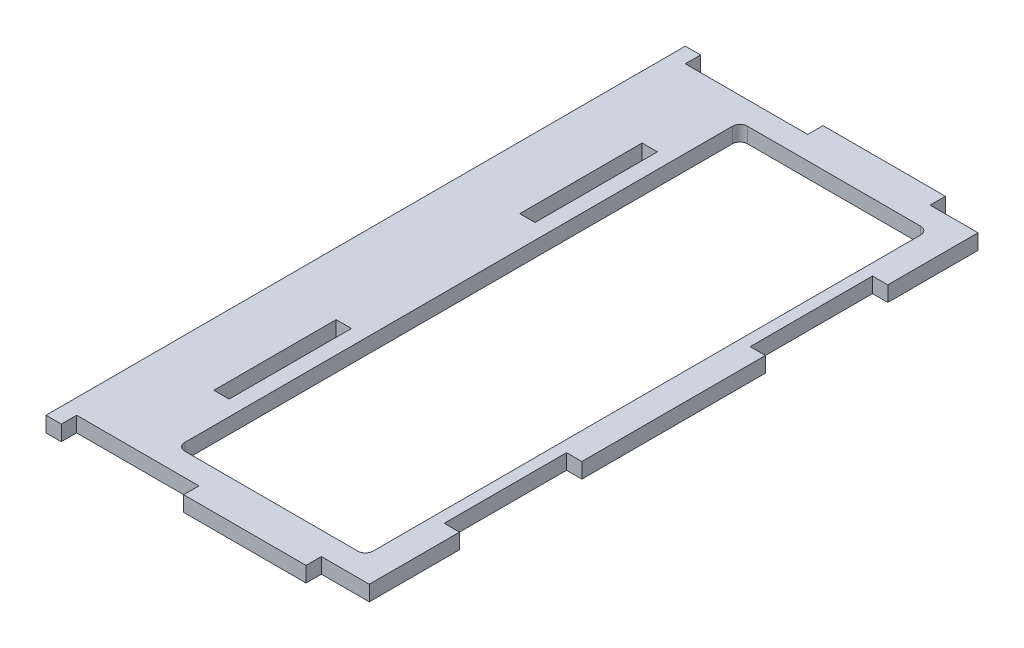
from build123d import *

# Parameters (mm, degrees)
SKETCH5_W           = 395.4
SKETCH5_H           = 265.4
BOSS_EXTRUDE3_DEPTH = 6.35
SKETCH6_W           = 78.175
SKETCH6_H           = 243.175
SKETCH6_W_2         = 75
SKETCH6_H_2         = 240
CUT_EXTRUDE1_DEPTH  = 6.35
SKETCH10_W          = 6.35
SKETCH10_H          = 50.8
SKETCH10_W_2        = 50.8
SKETCH10_H_2        = 6.35
CUT_EXTRUDE2_DEPTH  = 6.35
SKETCH11_W          = 50.8
SKETCH11_H          = 6.35
CUT_EXTRUDE3_DEPTH  = 6.35
SKETCH12_W          = 78.175
SKETCH12_H          = 4.7625
BOSS_EXTRUDE4_DEPTH = 6.35
FILLET1_R           = 3.175
CUT_EXTRUDE4_DEPTH  = 239.190895082


with BuildPart() as part:
    # Sketch5 → Boss-Extrude3 (new body)
    with BuildSketch(Plane(origin=(0, 0, 0), x_dir=(1, 0, 0), z_dir=(0, 1, 0))):
        Rectangle(SKETCH5_W, SKETCH5_H)
    extrude(amount=BOSS_EXTRUDE3_DEPTH)

    # Sketch6 → Cut-Extrude1 (cut)
    # profile 1 of 4: a face of its own
    with BuildSketch(Plane(origin=(0, 6.35, 0), x_dir=(1, 0, 0), z_dir=(0, 1, 0))):
        with Locations((147.5, 0)):
            Rectangle(SKETCH6_W, SKETCH6_H)
        with Locations((147.5, 0)):
            Rectangle(SKETCH6_W_2, SKETCH6_H_2, mode=Mode.SUBTRACT)
    # profile 2 of 4: a face of its own
    with BuildSketch(Plane(origin=(0, 6.35, 0), x_dir=(1, 0, 0), z_dir=(0, 1, 0))):
        with Locations((147.5, 0)):
            Rectangle(SKETCH6_W_2, SKETCH6_H_2)
    # profile 3 of 4: a face of its own
    with BuildSketch(Plane(origin=(0, 6.35, 0), x_dir=(1, 0, 0), z_dir=(0, 1, 0))):
        with Locations((-147.5, 0)):
            Rectangle(SKETCH6_W, SKETCH6_H)
        with Locations((-147.5, 0)):
            Rectangle(SKETCH6_W_2, SKETCH6_H_2, mode=Mode.SUBTRACT)
    # profile 4 of 4: a face of its own
    with BuildSketch(Plane(origin=(0, 6.35, 0), x_dir=(1, 0, 0), z_dir=(0, 1, 0))):
        with Locations((-147.5, 0)):
            Rectangle(SKETCH6_W_2, SKETCH6_H_2)
    extrude(amount=-CUT_EXTRUDE1_DEPTH, mode=Mode.SUBTRACT)

    # Sketch10 → Cut-Extrude2 (cut)
    with BuildSketch(Plane.XZ):
        with Locations((98.8875, -63.5)):
            Rectangle(SKETCH10_W, SKETCH10_H)
        with Locations((98.8875, 63.5)):
            Rectangle(SKETCH10_W, SKETCH10_H)
        with Locations((-98.8875, 63.5)):
            Rectangle(SKETCH10_W, SKETCH10_H)
        with Locations((-98.8875, -63.5)):
            Rectangle(SKETCH10_W, SKETCH10_H)
        Polygon((197.7, 132.7), (177.8, 132.7), (177.8, 126.35), (191.35, 126.35), (197.7, 126.35), align=None)
        Polygon((127, 132.7), (76.2, 132.7), (76.2, 126.35), (95.7125, 126.35), (102.0625, 126.35), (108.4125, 126.35), (127, 126.35), align=None)
        with Locations((0, 129.525)):
            Rectangle(SKETCH10_W_2, SKETCH10_H_2)
        Polygon((-127, 132.7), (-127, 126.35), (-108.4125, 126.35), (-102.0625, 126.35), (-95.7125, 126.35), (-76.2, 126.35), (-76.2, 132.7), align=None)
        Polygon((-197.7, 126.35), (-191.35, 126.35), (-177.8, 126.35), (-177.8, 132.7), (-197.7, 132.7), align=None)
        Polygon((-177.8, -126.35), (-191.35, -126.35), (-197.7, -126.35), (-197.7, -132.7), (-177.8, -132.7), align=None)
        Polygon((-108.4125, -126.35), (-127, -126.35), (-127, -132.7), (-76.2, -132.7), (-76.2, -126.35), (-95.7125, -126.35), (-102.0625, -126.35), align=None)
        with Locations((0, -129.525)):
            Rectangle(SKETCH10_W_2, SKETCH10_H_2)
        Polygon((76.2, -126.35), (76.2, -132.7), (127, -132.7), (127, -126.35), (108.4125, -126.35), (102.0625, -126.35), (95.7125, -126.35), align=None)
        Polygon((177.8, -126.35), (177.8, -132.7), (197.7, -132.7), (197.7, -126.35), (191.35, -126.35), align=None)
    extrude(amount=-CUT_EXTRUDE2_DEPTH, mode=Mode.SUBTRACT)

    # Sketch11 → Cut-Extrude3 (cut)
    with BuildSketch(Plane(origin=(197.7, 0, 0), x_dir=(0, 0, -1), z_dir=(1, 0, 0))):
        with Locations((-63.5, 3.175)):
            Rectangle(SKETCH11_W, SKETCH11_H)
        with Locations((63.5, 3.175)):
            Rectangle(SKETCH11_W, SKETCH11_H)
    cut_extrude3 = extrude(amount=-CUT_EXTRUDE3_DEPTH, mode=Mode.SUBTRACT)

    # Mirror1: Cut-Extrude3 across plane
    add(cut_extrude3.mirror(Plane(origin=(0, 0, 0), x_dir=(0, 0, 1), z_dir=(1, 0, 0))), mode=Mode.SUBTRACT)

    # Sketch12 → Boss-Extrude4 (add)
    with BuildSketch(Plane.XZ):
        with Locations((147.5, -119.20625)):
            Rectangle(SKETCH12_W, SKETCH12_H)
        with Locations((147.5, 119.20625)):
            Rectangle(SKETCH12_W, SKETCH12_H)
        with Locations((-147.5, 119.20625)):
            Rectangle(SKETCH12_W, SKETCH12_H)
        with Locations((-147.5, -119.20625)):
            Rectangle(SKETCH12_W, SKETCH12_H)
    extrude(amount=-BOSS_EXTRUDE4_DEPTH)

    # Fillet1
    fillet1_edges = [part.edges().sort_by_distance(p)[0] for p in [
        (108.4125, 3.175, -116.825),
        (186.5875, 3.175, -116.825),
        (186.5875, 3.175, 116.825),
        (108.4125, 3.175, 116.825),
        (-186.5875, 3.175, 116.825),
        (-108.4125, 3.175, 116.825),
        (-108.4125, 3.175, -116.825),
        (-186.5875, 3.175, -116.825),
    ]]
    fillet(fillet1_edges, radius=FILLET1_R)

    # Sketch13 → Cut-Extrude4 (cut, through all)
    with BuildSketch(Plane.XZ):
        Polygon((25.4, -132.7), (69.85, -132.7), (69.85, 132.7), (25.4, 132.7), (25.4, 126.35), (-25.4, 126.35), (-25.4, 132.7), (-69.85, 132.7), (-69.85, -132.7), (-25.4, -132.7), (-25.4, -126.35), (25.4, -126.35), align=None)
        Polygon((-76.2, -132.7), (-69.85, -132.7), (-69.85, 132.7), (-76.2, 132.7), (-76.2, 126.35), (-127, 126.35), (-127, 132.7), (-177.8, 132.7), (-177.8, 126.35), (-197.7, 126.35), (-197.7, 88.9), (-191.35, 88.9), (-191.35, 38.1), (-197.7, 38.1), (-197.7, -38.1), (-191.35, -38.1), (-191.35, -88.9), (-197.7, -88.9), (-197.7, -126.35), (-177.8, -126.35), (-177.8, -132.7), (-127, -132.7), (-127, -126.35), (-76.2, -126.35), align=None)
    extrude(amount=-CUT_EXTRUDE4_DEPTH, mode=Mode.SUBTRACT)


solid = part.part
